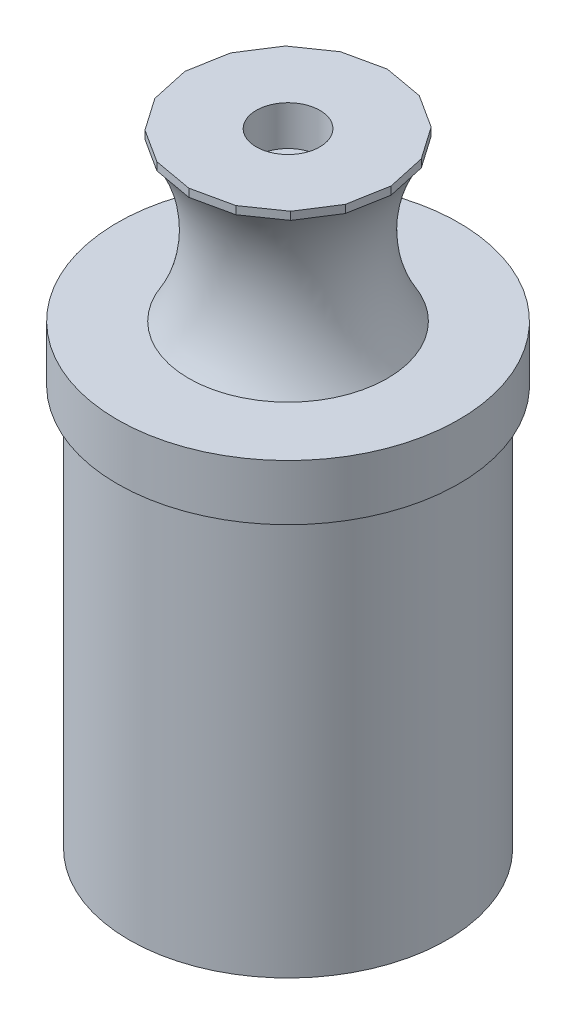
from build123d import *

# Parameters (mm, degrees)
SKETCH1_R           = 20
BOSS_EXTRUDE1_DEPTH = 50.5
SKETCH2_R           = 21.5
BOSS_EXTRUDE2_DEPTH = 7
BOSS_EXTRUDE3_DEPTH = 1
SKETCH5_R           = 5
CUT_EXTRUDE1_DEPTH  = 1
SKETCH6_R           = 4
CUT_EXTRUDE2_DEPTH  = 5


with BuildPart() as part:
    # Sketch1 → Boss-Extrude1 (new body)
    with BuildSketch(Plane(origin=(0, 0, 0), x_dir=(1, 0, 0), z_dir=(0, 1, 0))):
        with Locations(Location((0, 0, 0), (0, 0, 270))):
            Circle(SKETCH1_R)
    extrude(amount=BOSS_EXTRUDE1_DEPTH)

    # Sketch2 → Boss-Extrude2 (add)
    with BuildSketch(Plane(origin=(0, 50.5, 0), x_dir=(1, 0, 0), z_dir=(0, 1, 0))):
        with Locations(Location((0, 0, 0), (0, 0, 270))):
            Circle(SKETCH2_R)
    extrude(amount=BOSS_EXTRUDE2_DEPTH)

    # Sketch3 → Revolve1 (revolve)
    with BuildSketch(Plane.XY, mode=Mode.PRIVATE) as revolve1_sk:
        with BuildLine():
            Line((0, 77.5), (12.5, 77.5))
            ThreePointArc((12.5, 77.5), (9.674701278, 67.5), (12.5, 57.5))
            Line((12.5, 57.5), (0, 57.5))
            Line((0, 57.5), (0, 77.5))
        make_face()
    revolve(revolve1_sk.sketch.rotate(Axis((0, 57.5, 0), (0, 1, 0)), 90), axis=Axis((0, 57.5, 0), (0, 1, 0)))

    # Sketch4 → Boss-Extrude3 (add)
    with BuildSketch(Plane(origin=(0, 77.5, 0), x_dir=(1, 0, 0), z_dir=(0, 1, 0))):
        Polygon((8.841834545, 9.179007009), (4.656136058, 11.863920297), (-0.238416936, 12.742659266), (-5.096673112, 11.681443874), (-9.179007009, 8.841834545), (-11.863920297, 4.656136058), (-12.742659266, -0.238416936), (-11.681443874, -5.096673112), (-8.841834545, -9.179007009), (-4.656136058, -11.863920297), (0.238416936, -12.742659266), (5.096673112, -11.681443874), (9.179007009, -8.841834545), (11.863920297, -4.656136058), (12.742659266, 0.238416936), (11.681443874, 5.096673112), align=None)
    extrude(amount=BOSS_EXTRUDE3_DEPTH)

    # Sketch5 → Cut-Extrude1 (cut)
    with BuildSketch(Plane.XZ):
        with Locations(Location((0, 0, 0), (0, 0, 270))):
            Circle(SKETCH5_R)
    extrude(amount=-CUT_EXTRUDE1_DEPTH, mode=Mode.SUBTRACT)

    # Sketch6 → Cut-Extrude2 (cut)
    with BuildSketch(Plane(origin=(0, 78.5, 0), x_dir=(1, 0, 0), z_dir=(0, 1, 0))):
        with Locations(Location((0, 0, 0), (0, 0, 270))):
            Circle(SKETCH6_R)
    extrude(amount=-CUT_EXTRUDE2_DEPTH, mode=Mode.SUBTRACT)


solid = part.part
